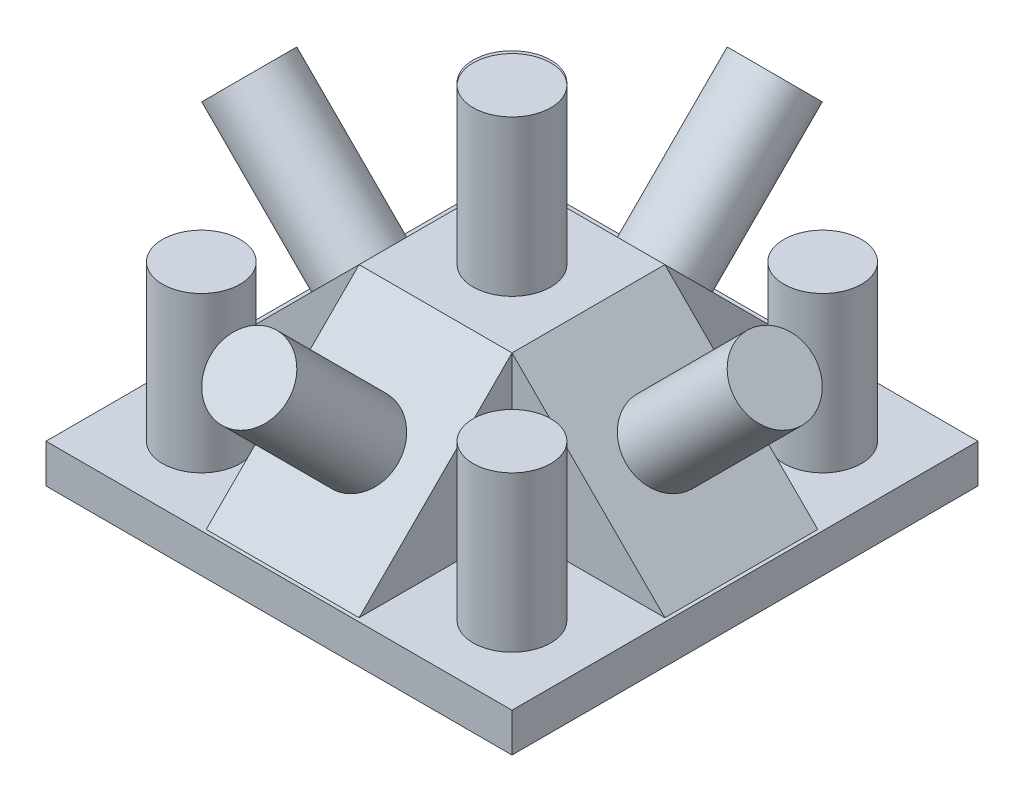
from build123d import *

# Parameters (mm, degrees)
SKETCH1_W           = 152.4
SKETCH1_H           = 152.4
BOSS_EXTRUDE1_DEPTH = 12.7
SKETCH2_R           = 12.7
BOSS_EXTRUDE2_DEPTH = 50.8
BOSS_EXTRUDE3_DEPTH = 50
CUT_EXTRUDE1_DEPTH  = 50
CUT_EXTRUDE2_DEPTH  = 50
SKETCH6_R           = 12.7
BOSS_EXTRUDE4_DEPTH = 50.8
SKETCH7_R           = 12.7
BOSS_EXTRUDE5_DEPTH = 50.8
SKETCH8_R           = 12.7
BOSS_EXTRUDE6_DEPTH = 50.8
SKETCH9_R           = 12.7
BOSS_EXTRUDE7_DEPTH = 50.8
SKETCH10_R          = 12.7
BOSS_EXTRUDE8_DEPTH = 50.8


with BuildPart() as part:
    # Sketch1 → Boss-Extrude1 (new body)
    with BuildSketch(Plane(origin=(0, 0, 0), x_dir=(1, 0, 0), z_dir=(0, 1, 0))):
        with Locations((76.2, 76.2)):
            Rectangle(SKETCH1_W, SKETCH1_H)
    extrude(amount=-BOSS_EXTRUDE1_DEPTH)

    # Sketch2 → Boss-Extrude2 (add)
    with BuildSketch(Plane(origin=(0, 0, 0), x_dir=(1, 0, 0), z_dir=(0, 1, 0))):
        with Locations(Location((25.4, 127, 0), (0, 0, 270))):
            Circle(SKETCH2_R)
        with Locations(Location((127, 127, 0), (0, 0, 270))):
            Circle(SKETCH2_R)
        with Locations(Location((127, 25.4, 0), (0, 0, 270))):
            Circle(SKETCH2_R)
        with Locations(Location((25.4, 25.4, 0), (0, 0, 270))):
            Circle(SKETCH2_R)
    extrude(amount=BOSS_EXTRUDE2_DEPTH)

    # Sketch3 → Boss-Extrude3 (add)
    with BuildSketch(Plane(origin=(0, 0, 0), x_dir=(1, 0, 0), z_dir=(0, 1, 0))):
        Polygon((51.2, 151.2), (51.2, 101.2), (1.2, 101.2), (1.2, 51.2), (51.2, 51.2), (51.2, 1.2), (101.2, 1.2), (101.2, 51.2), (151.2, 51.2), (151.2, 101.2), (101.2, 101.2), (101.2, 151.2), align=None)
    extrude(amount=BOSS_EXTRUDE3_DEPTH)

    # Sketch4 → Cut-Extrude1 (cut)
    with BuildSketch(Plane.XY.offset(-51.2)):
        Polygon((1.2, 0), (51.2, 50), (1.2, 50), align=None)
        Polygon((101.2, 50), (151.2, 0), (151.2, 50), align=None)
    extrude(amount=-CUT_EXTRUDE1_DEPTH, mode=Mode.SUBTRACT)

    # Sketch5 → Cut-Extrude2 (cut)
    with BuildSketch(Plane(origin=(101.2, 0, 0), x_dir=(0, 0, -1), z_dir=(1, 0, 0))):
        Polygon((1.2, 0), (51.2, 50), (1.2, 50), align=None)
        Polygon((101.2, 50), (151.2, 0), (151.2, 50), align=None)
    extrude(amount=-CUT_EXTRUDE2_DEPTH, mode=Mode.SUBTRACT)

    # Sketch6 → Boss-Extrude4 (add)
    with BuildSketch(Plane(origin=(75.6, 75.6, 0), x_dir=(0, 0, -1), z_dir=(0.7071067811865475, 0.7071067811865477, 0))):
        with Locations(Location((76.2, -71.559206256, 0), (0, 0, 270))):
            Circle(SKETCH6_R)
    extrude(amount=BOSS_EXTRUDE4_DEPTH)

    # Sketch7 → Boss-Extrude5 (add)
    with BuildSketch(Plane(origin=(0, 75.6, -75.6), x_dir=(1, 0, 0), z_dir=(0, 0.7071067811865476, -0.7071067811865475))):
        with Locations(Location((76.2, 71.559206256, 0), (0, 0, 90))):
            Circle(SKETCH7_R)
    extrude(amount=BOSS_EXTRUDE5_DEPTH)

    # Sketch8 → Boss-Extrude6 (add)
    with BuildSketch(Plane(origin=(0.6, -0.6, 0), x_dir=(0, 0, 1), z_dir=(-0.7071067811865476, 0.7071067811865475, 0))):
        with Locations(Location((-76.2, 36.203867197, 0), (0, 0, 90))):
            Circle(SKETCH8_R)
    extrude(amount=BOSS_EXTRUDE6_DEPTH)

    # Sketch9 → Boss-Extrude7 (add)
    with BuildSketch(Plane(origin=(0, -0.6, -0.6), x_dir=(1, 0, 0), z_dir=(0, 0.7071067811865477, 0.7071067811865475))):
        with Locations(Location((76.2, 36.203867197, 0), (0, 0, 90))):
            Circle(SKETCH9_R)
    extrude(amount=BOSS_EXTRUDE7_DEPTH)

    # Sketch10 → Boss-Extrude8 (add)
    with BuildSketch(Plane(origin=(0, 50, 0), x_dir=(1, 0, 0), z_dir=(0, 1, 0))):
        with Locations(Location((76.2, 76.2, 0), (0, 0, 270))):
            Circle(SKETCH10_R)
    extrude(amount=BOSS_EXTRUDE8_DEPTH)


solid = part.part
